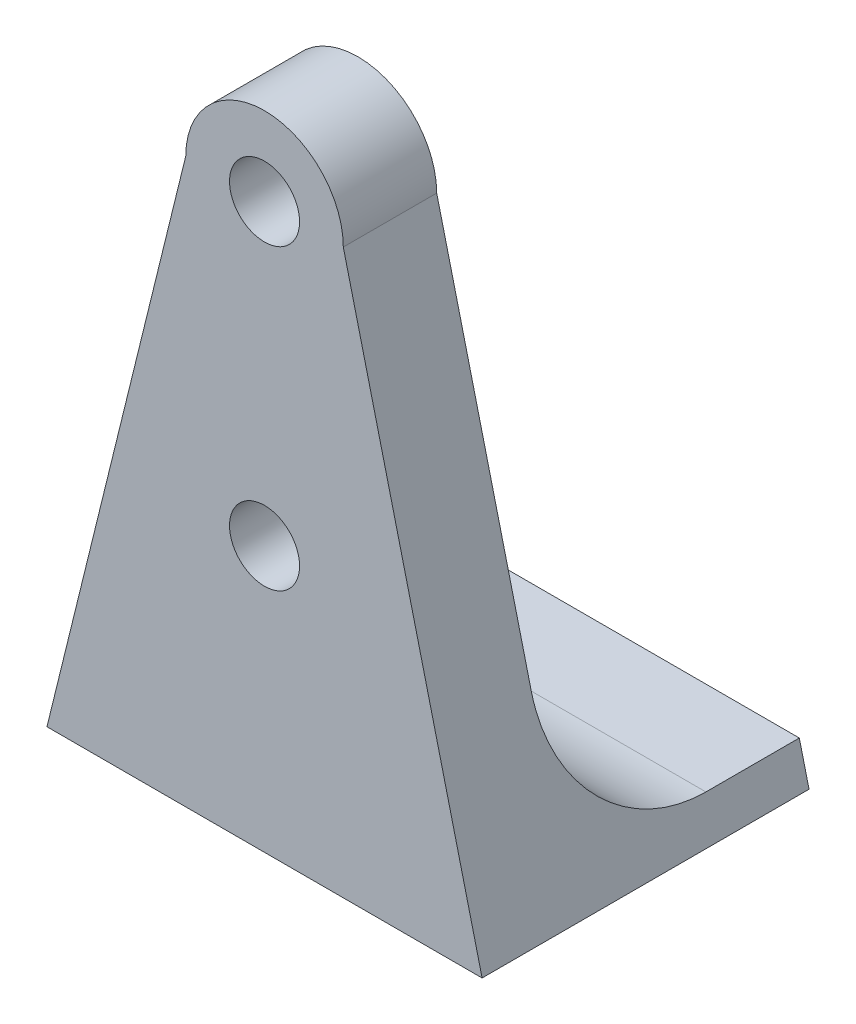
from build123d import *

# Parameters (mm, degrees)
BOSS_EXTRUDE1_DEPTH   = 2
BOSS_EXTRUDE2_DEPTH   = 5
FILLET1_R             = 3
F_1_5MM_DOWEL_HOLE1_D = 1.5


with BuildPart() as part:
    # Sketch1 → Boss-Extrude1 (new body)
    with BuildSketch(Plane.XY):
        with BuildLine():
            Line((-1.686437718, 8.505953435), (-4.658536585, -3.56097561))
            Line((-4.658536585, -3.56097561), (4.658536585, -3.56097561))
            Line((4.658536585, -3.56097561), (1.686437718, 8.505953435))
            ThreePointArc((1.686437718, 8.505953435), (0, 10.192391153), (-1.686437718, 8.505953435))
        make_face()
    extrude(amount=BOSS_EXTRUDE1_DEPTH)

    # Sketch2 → Boss-Extrude2 (add)
    with BuildSketch(Plane(origin=(0, 0, 0), x_dir=(-1, 0, 0), z_dir=(0, 0, -1))):
        Polygon((-4.450149656, -2.714910119), (4.450149656, -2.714910119), (4.658536585, -3.56097561), (-4.658536585, -3.56097561), align=None)
    extrude(amount=BOSS_EXTRUDE2_DEPTH)

    # Fillet1
    fillet1_edges = [part.edges().sort_by_distance(p)[0] for p in [
        (0, -2.714910119, 0),
    ]]
    fillet(fillet1_edges, radius=FILLET1_R)

    # Ø1.5mm Dowel Hole1 (through all)
    with Locations(Plane.XY.offset(2)):
        with Locations((0, 8.505953435), (0, 2.123465087)):
            Hole(F_1_5MM_DOWEL_HOLE1_D / 2)


solid = part.part
